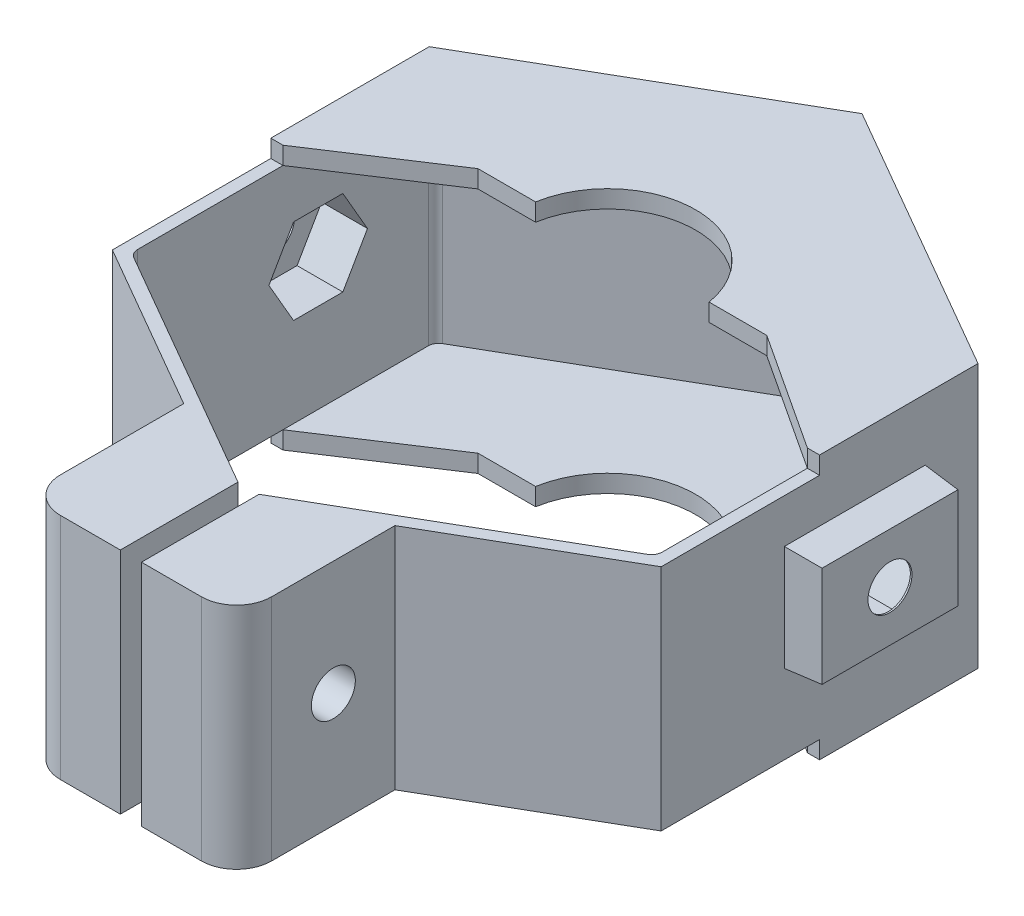
from build123d import *

# Parameters (mm, degrees)
BOSS_EXTRUDE1_DEPTH = 16.51
CUT_EXTRUDE1_DEPTH  = 50.74516387
SKETCH4_R           = 1.5875
CUT_EXTRUDE2_DEPTH  = 54.238681437
BOSS_EXTRUDE3_DEPTH = 1.27
BOSS_EXTRUDE4_DEPTH = 1.27
SKETCH11_W          = 10.16
SKETCH11_H          = 7.62
BOSS_EXTRUDE5_DEPTH = 2.54
BOSS_EXTRUDE5_TAPER = 4
SKETCH12_R          = 1.5875
CUT_EXTRUDE3_DEPTH  = 63.462199051
CUT_EXTRUDE4_DEPTH  = 3.302
FILLET1_R           = 0.762
SKETCH14_R          = 1.5875
CUT_EXTRUDE6_DEPTH  = 65.202975796
CUT_EXTRUDE7_DEPTH  = 3.302
CUT_EXTRUDE10_DEPTH = 76.2


with BuildPart() as part:
    # Sketch1 → Boss-Extrude1 (new body)
    with BuildSketch(Plane(origin=(0, 0, 0), x_dir=(1, 0, 0), z_dir=(0, 1, 0))):
        with BuildLine():
            Line((-7.62, -31.114876642), (-7.62, -40.004876642))
            ThreePointArc((-7.62, -40.004876642), (-6.876051224, -41.800927866), (-5.08, -42.544876642))
            Line((-5.08, -42.544876642), (5.08, -42.544876642))
            ThreePointArc((5.08, -42.544876642), (6.876051224, -41.800927866), (7.62, -40.004876642))
            Line((7.62, -40.004876642), (7.62, -31.114876642))
            Line((7.62, -31.114876642), (19.797340731, -24.084285693))
            Line((19.797340731, -24.084285693), (19.797340731, -1.224285693))
            Line((19.797340731, -1.224285693), (0, 10.205714307))
            Line((0, 10.205714307), (-19.797340731, -1.224285693))
            Line((-19.797340731, -1.224285693), (-19.797340731, -24.084285693))
            Line((-19.797340731, -24.084285693), (-7.62, -31.114876642))
        make_face()
        Polygon((0, 9.189714307), (-18.91745892, -1.732285693), (-18.91745892, -23.576285693), (0, -34.498285693), (18.91745892, -23.576285693), (18.91745892, -1.732285693), align=None, mode=Mode.SUBTRACT)
    extrude(amount=BOSS_EXTRUDE1_DEPTH)

    # Sketch2 → Cut-Extrude1 (cut, through all)
    with BuildSketch(Plane(origin=(0, 16.51, 0), x_dir=(1, 0, 0), z_dir=(0, 1, 0))):
        Polygon((-0.762, -34.058344788), (-0.762, -42.544876642), (0.762, -42.544876642), (0.762, -34.058344788), (0, -34.498285693), align=None)
    extrude(amount=-CUT_EXTRUDE1_DEPTH, mode=Mode.SUBTRACT)

    # Sketch4 → Cut-Extrude2 (cut, through all)
    with BuildSketch(Plane.ZY.offset(7.62)):
        with Locations((35.559876642, 8.255)):
            Circle(SKETCH4_R)
    extrude(amount=-CUT_EXTRUDE2_DEPTH, mode=Mode.SUBTRACT)

    # Sketch8 → Boss-Extrude3 (add)
    with BuildSketch(Plane(origin=(0, 16.51, 0), x_dir=(1, 0, 0), z_dir=(0, 1, 0))):
        Polygon((-10.419364221, -7.085804169), (10.419364221, -7.085804169), (18.91745892, -12.654285693), (19.797340731, -12.654285693), (19.797340731, -1.224285693), (0, 10.205714307), (-19.797340731, -1.224285693), (-19.797340731, -12.654285693), (-18.91745892, -12.654285693), align=None)
    extrude(amount=BOSS_EXTRUDE3_DEPTH)

    # Sketch9 → Boss-Extrude4 (add)
    with BuildSketch(Plane.XZ):
        Polygon((-10.419364221, 7.085804169), (10.419364221, 7.085804169), (18.91745892, 12.654285693), (19.797340731, 12.654285693), (19.797340731, 1.224285693), (0, -10.205714307), (-19.797340731, 1.224285693), (-19.797340731, 12.654285693), (-18.91745892, 12.654285693), align=None)
    extrude(amount=BOSS_EXTRUDE4_DEPTH)

    # Sketch11 → Boss-Extrude5 (add)
    with BuildSketch(Plane.ZY.offset(19.797340731)):
        with Locations((10.114285693, 9.525)):
            Rectangle(SKETCH11_W, SKETCH11_H)
    boss_extrude5 = extrude(amount=BOSS_EXTRUDE5_DEPTH, taper=BOSS_EXTRUDE5_TAPER)

    # Sketch12 → Cut-Extrude3 (cut, through all)
    with BuildSketch(Plane.ZY.offset(22.337340731)):
        with Locations((10.114285693, 9.525)):
            Circle(SKETCH12_R)
    extrude(amount=-CUT_EXTRUDE3_DEPTH, mode=Mode.SUBTRACT)

    # Sketch13 → Cut-Extrude4 (cut)
    with BuildSketch(Plane(origin=(-18.91745892, 0, 0), x_dir=(0, 0, -1), z_dir=(1, 0, 0))):
        Polygon((-8.336285693, 12.604586336), (-11.892285693, 12.604586336), (-13.670285693, 9.525), (-11.892285693, 6.445413664), (-8.336285693, 6.445413664), (-6.558285693, 9.525), align=None)
    cut_extrude4 = extrude(amount=-CUT_EXTRUDE4_DEPTH, mode=Mode.SUBTRACT)

    # Mirror1: Boss-Extrude5, Cut-Extrude4 across plane
    add(boss_extrude5.mirror(Plane(origin=(0, 0, 0), x_dir=(0, 0, 1), z_dir=(1, 0, 0))))
    add(cut_extrude4.mirror(Plane(origin=(0, 0, 0), x_dir=(0, 0, 1), z_dir=(1, 0, 0))), mode=Mode.SUBTRACT)

    # Fillet1
    fillet1_edges = [part.edges().sort_by_distance(p)[0] for p in [
        (18.91745892, 8.255, 1.732285693),
        (0, 8.255, -9.189714307),
        (-18.91745892, 8.255, 1.732285693),
        (-18.91745892, 8.255, 23.576285693),
        (18.91745892, 8.255, 23.576285693),
    ]]
    fillet(fillet1_edges, radius=FILLET1_R)

    # Sketch14 → Cut-Extrude6 (cut, through all)
    with BuildSketch(Plane(origin=(22.337340731, 0, 0), x_dir=(0, 0, -1), z_dir=(1, 0, 0))):
        with Locations(Location((-10.114285693, 9.525, 0), (0, 0, 180))):
            Circle(SKETCH14_R)
    extrude(amount=-CUT_EXTRUDE6_DEPTH, mode=Mode.SUBTRACT)

    # Sketch15 → Cut-Extrude7 (cut)
    with BuildSketch(Plane.ZY.offset(7.62)):
        Polygon((35.559876642, 11.811), (32.480290306, 10.033), (32.480290306, 6.477), (35.559876642, 4.699), (38.639462978, 6.477), (38.639462978, 10.033), align=None)
    extrude(amount=-CUT_EXTRUDE7_DEPTH, mode=Mode.SUBTRACT)

    # Sketch16 → Cut-Extrude10 (cut)
    with BuildSketch(Plane(origin=(0, 17.78, 0), x_dir=(1, 0, 0), z_dir=(0, 1, 0))):
        with BuildLine():
            Line((-6.260612009, -7.085804169), (6.260612009, -7.085804169))
            ThreePointArc((6.260612009, -7.085804169), (0, -1.797518476), (-6.260612009, -7.085804169))
        make_face()
    extrude(amount=-CUT_EXTRUDE10_DEPTH, mode=Mode.SUBTRACT)


solid = part.part
